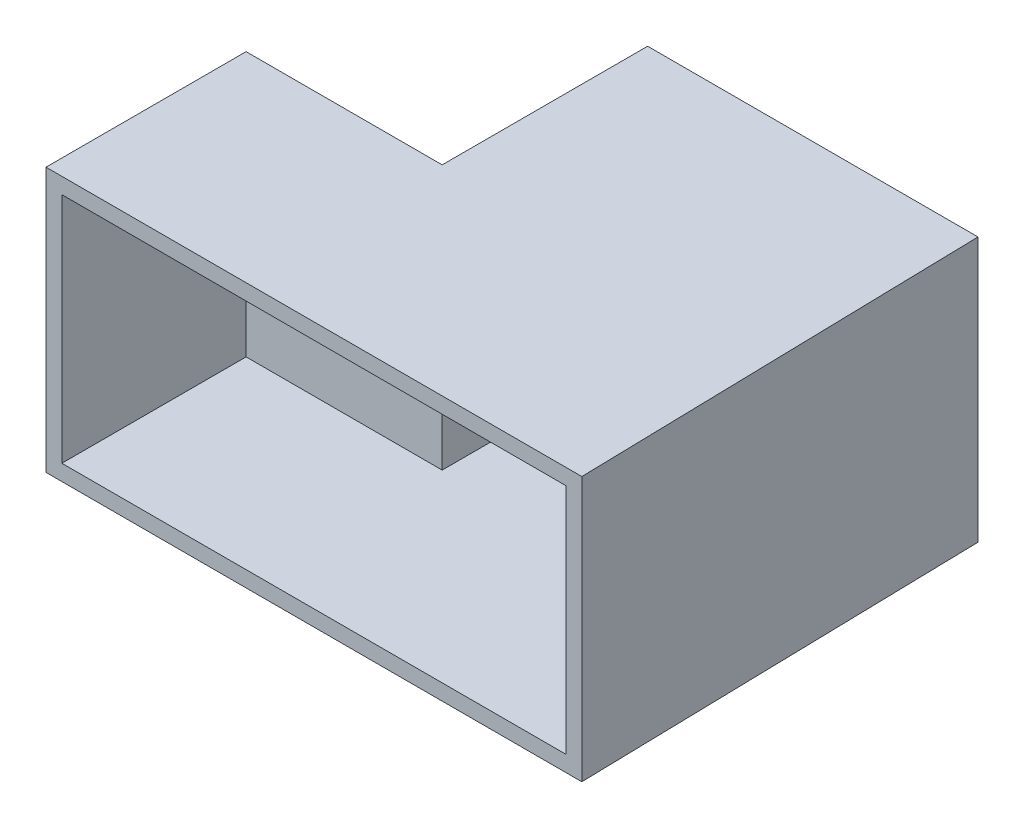
from build123d import *

# Parameters (mm, degrees)
BOSS_EXTRUDE1_DEPTH = 50
SHELL1_T            = -3


with BuildPart() as part:
    # Sketch1 → Boss-Extrude1 (new body)
    with BuildSketch(Plane(origin=(0, 0, 0), x_dir=(1, 0, 0), z_dir=(0, 1, 0))):
        Polygon((-25.019, 12.954), (-25.019, -25.908), (-62.103, -25.908), (-62.103, -63.754), (39.243, -63.754), (37.465, 12.954), align=None)
    extrude(amount=BOSS_EXTRUDE1_DEPTH)

    # Shell1
    shell1_openings = [part.faces().sort_by_distance(p)[0] for p in [
        (-11.43, 25, 63.754),
    ]]
    offset(amount=SHELL1_T, openings=shell1_openings, kind=Kind.INTERSECTION)


solid = part.part
